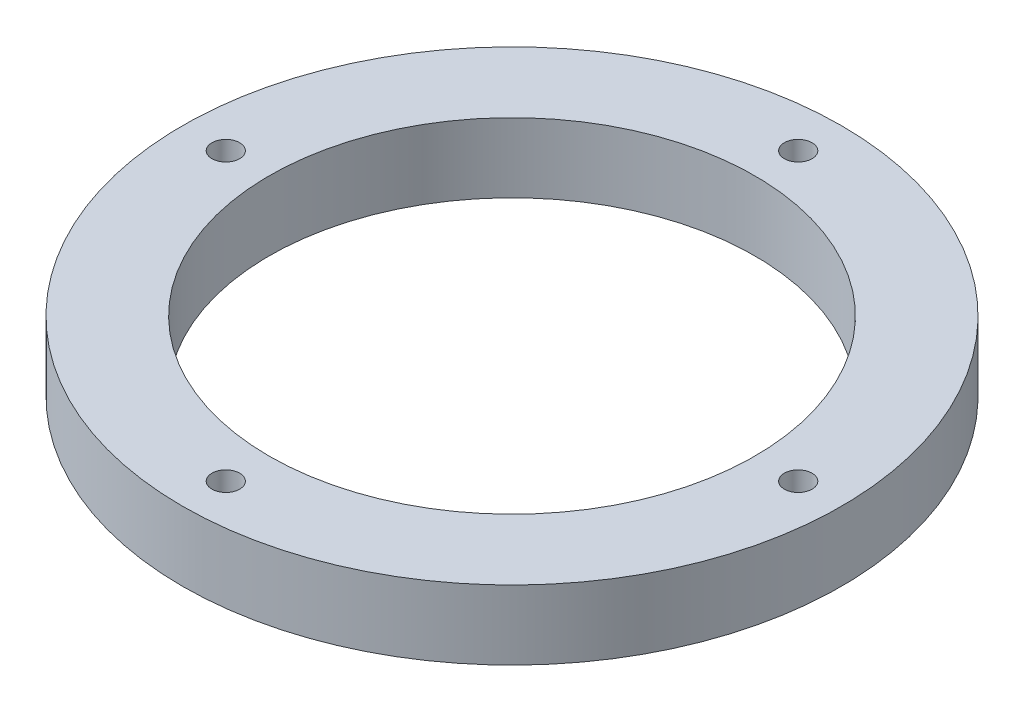
from build123d import *

# Parameters (mm, degrees)
SKETCH1_R           = 47.5
BOSS_EXTRUDE1_DEPTH = 10
SKETCH2_R           = 35
CUT_EXTRUDE1_DEPTH  = 10
SKETCH3_R           = 2
CUT_EXTRUDE2_DEPTH  = 10
CIRPATTERN1_COUNT   = 4


with BuildPart() as part:
    # Sketch1 → Boss-Extrude1 (new body)
    with BuildSketch(Plane(origin=(0, 0, 0), x_dir=(1, 0, 0), z_dir=(0, 1, 0))):
        with Locations(Location((0, 0, 0), (0, 0, 270))):
            Circle(SKETCH1_R)
    extrude(amount=BOSS_EXTRUDE1_DEPTH)

    # Sketch2 → Cut-Extrude1 (cut)
    with BuildSketch(Plane(origin=(0, 10, 0), x_dir=(1, 0, 0), z_dir=(0, 1, 0))):
        with Locations(Location((0, 0, 0), (0, 0, 270))):
            Circle(SKETCH2_R)
    extrude(amount=-CUT_EXTRUDE1_DEPTH, mode=Mode.SUBTRACT)

    # Sketch3 → Cut-Extrude2 (cut)
    with BuildSketch(Plane(origin=(0, 10, 0), x_dir=(1, 0, 0), z_dir=(0, 1, 0))):
        with Locations(Location((0, 41.25, 0), (0, 0, 270))):
            Circle(SKETCH3_R)
    cut_extrude2 = extrude(amount=-CUT_EXTRUDE2_DEPTH, mode=Mode.SUBTRACT)

    # CirPattern1: Cut-Extrude2 ×4 about axis
    cirpattern1_axis = Axis((0, 0, 0), (0, 1, 0))
    for i in range(1, CIRPATTERN1_COUNT):
        add(cut_extrude2.rotate(cirpattern1_axis, i * 360 / CIRPATTERN1_COUNT), mode=Mode.SUBTRACT)


solid = part.part
